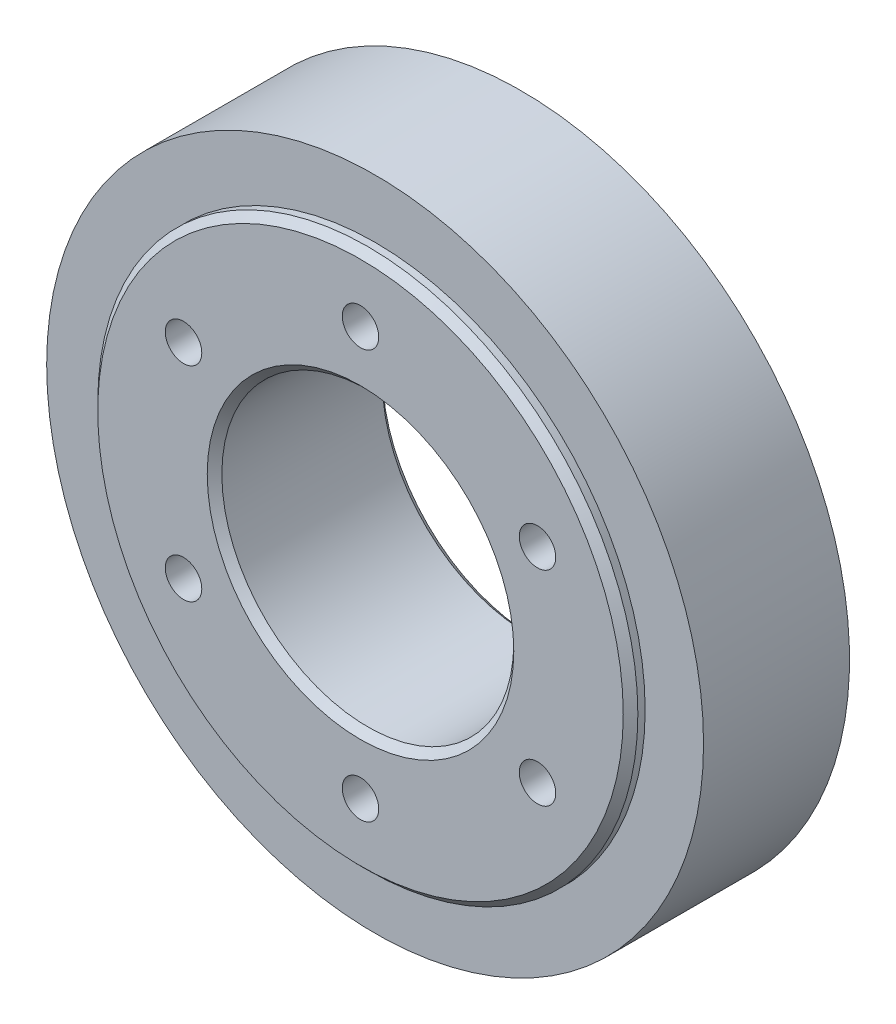
from build123d import *

# Parameters (mm, degrees)
SKETCH_1_R               = 22.5
SKETCH_1_R_2             = 10
EXTRUDE_1_DEPTH          = 6
SKETCH1_OUTSIDE_W        = 59.952
SKETCH1_OUTSIDE_H        = 59.952
SKETCH1_OUTSIDE_R        = 18.5
CUT_EXTRUDE1_DEPTH       = 1
M3_TAPPED_HOLE1_D        = 2.5
PATTERN_CIRCULAR_1_COUNT = 6
CHAMFER_1_SIZE           = 0.5


with BuildPart() as part:
    # 스케치1 → 보스-돌출1 (new, symmetric)
    with BuildSketch(Plane.XY):
        Circle(SKETCH_1_R)
        Circle(SKETCH_1_R_2, mode=Mode.SUBTRACT)
    extrude(amount=EXTRUDE_1_DEPTH, both=True)

    # Sketch1 outside → Cut-Extrude1 (cut)
    with BuildSketch(Plane(origin=(0, 0, -6), x_dir=(-1, 0, 0), z_dir=(0, 0, -1))):
        Rectangle(SKETCH1_OUTSIDE_W, SKETCH1_OUTSIDE_H)
        Circle(SKETCH1_OUTSIDE_R, mode=Mode.SUBTRACT)
    cut_extrude1 = extrude(amount=-CUT_EXTRUDE1_DEPTH, mode=Mode.SUBTRACT)

    # Mirror1: Cut-Extrude1 across plane
    add(cut_extrude1.mirror(Plane.XY), mode=Mode.SUBTRACT)

    # M3 Tapped Hole1 (through all)
    with Locations(Plane.XY.offset(6)):
        with Locations((0, 14)):
            m3_tapped_hole1 = Hole(M3_TAPPED_HOLE1_D / 2)

    # 원형 패턴1: M3 Tapped Hole1 ×6 about axis
    pattern_circular_1_axis = Axis((0, 0, 6), (0, 0, -1))
    for i in range(1, PATTERN_CIRCULAR_1_COUNT):
        add(m3_tapped_hole1.rotate(pattern_circular_1_axis, i * 360 / PATTERN_CIRCULAR_1_COUNT), mode=Mode.SUBTRACT)

    # 모따기1
    chamfer_1_edges = [part.edges().sort_by_distance(p)[0] for p in [
        (-10, 0, -6),
        (-10, 0, 6),
        (18.5, 0, 6),
        (18.5, 0, -6),
    ]]
    chamfer(chamfer_1_edges, length=CHAMFER_1_SIZE)


solid = part.part
